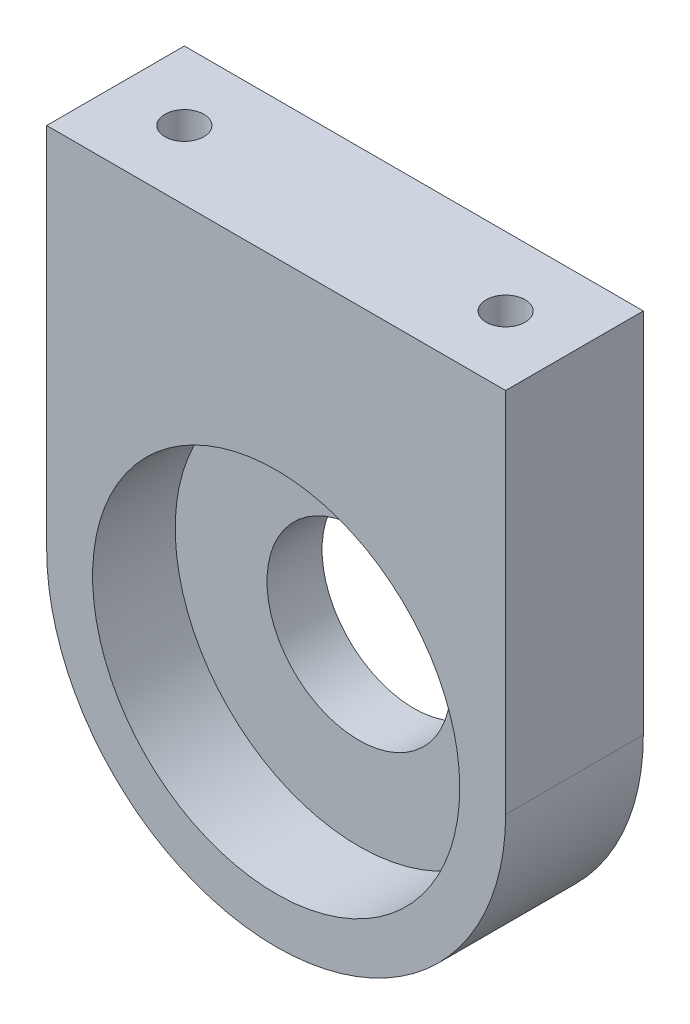
from build123d import *

# Parameters (mm, degrees)
BOSS_EXTRUDE1_DEPTH    = 15
SKETCH3_R              = 20
CUT_EXTRUDE1_DEPTH     = 99.994949366
SKETCH4_R              = 40
CUT_EXTRUDE2_DEPTH     = 18
M10_TAPPED_HOLE1_D     = 8.5
M10_TAPPED_HOLE1_DEPTH = 24.5
M10_TAPPED_HOLE1_TIP   = 4.25


with BuildPart() as part:
    # Sketch1 → Boss-Extrude1 (new, symmetric)
    with BuildSketch(Plane.XY):
        with BuildLine():
            Line((-50, 80), (-50, 0))
            ThreePointArc((-50, 0), (0, -50), (50, 0))
            Line((50, 0), (50, 80))
            Line((50, 80), (-50, 80))
        make_face()
    extrude(amount=BOSS_EXTRUDE1_DEPTH, both=True)

    # Sketch3 → Cut-Extrude1 (cut, through all)
    with BuildSketch(Plane.XY.offset(15)):
        Circle(SKETCH3_R)
    extrude(amount=-CUT_EXTRUDE1_DEPTH, mode=Mode.SUBTRACT)

    # Sketch4 → Cut-Extrude2 (cut)
    with BuildSketch(Plane.XY.offset(15)):
        Circle(SKETCH4_R)
    extrude(amount=-CUT_EXTRUDE2_DEPTH, mode=Mode.SUBTRACT)

    # M10 Tapped Hole1
    with Locations(Plane(origin=(-35, 80, 0), x_dir=(0, 0, 1), z_dir=(0, 1, 0))):
        with Locations((0, 0), (0, 70)):
            Hole(M10_TAPPED_HOLE1_D / 2, depth=M10_TAPPED_HOLE1_DEPTH)
            with Locations((0, 0, -(M10_TAPPED_HOLE1_DEPTH + M10_TAPPED_HOLE1_TIP / 2))):  # 90° drill point
                Cone(0, M10_TAPPED_HOLE1_D / 2, M10_TAPPED_HOLE1_TIP, mode=Mode.SUBTRACT)


solid = part.part
